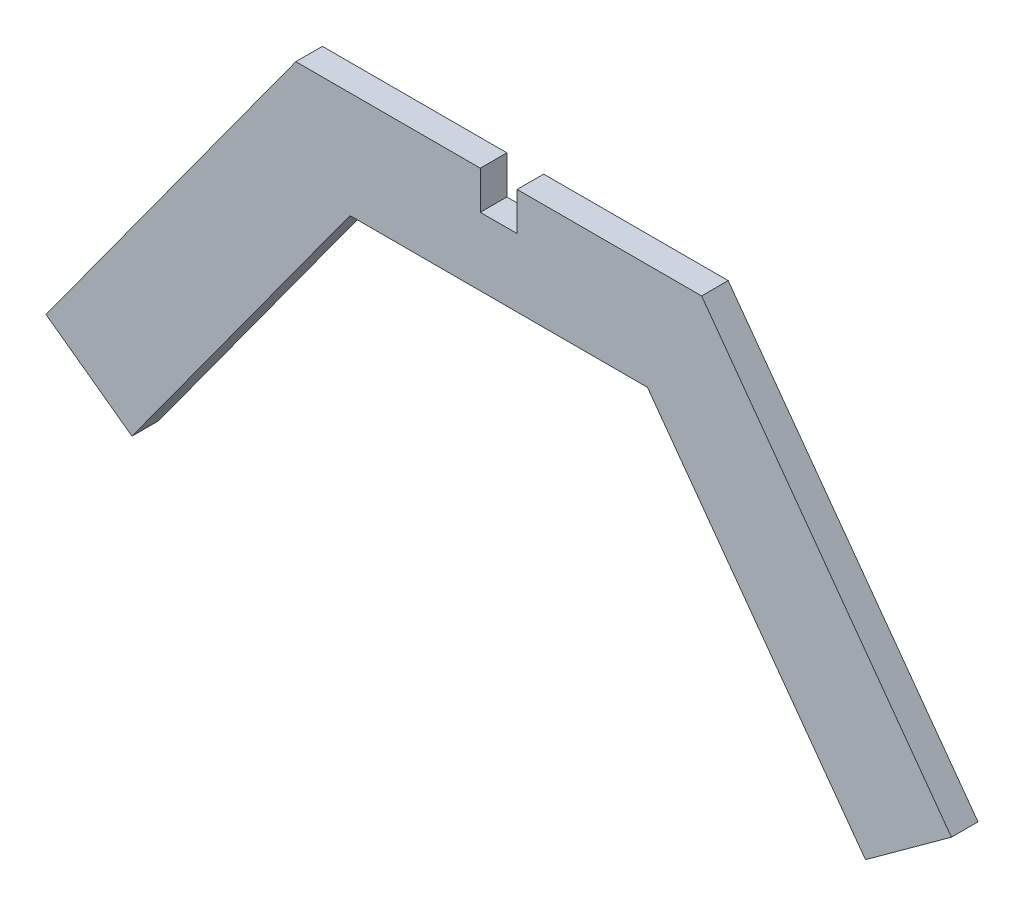
from build123d import *

# Parameters (mm, degrees)
BOSS_EXTRUDE1_DEPTH = 4.7625
SKETCH2_W           = 6.604
SKETCH2_H           = 6.858
CUT_EXTRUDE1_DEPTH  = 110.164366062


with BuildPart() as part:
    # Sketch1 → Boss-Extrude1 (new body)
    with BuildSketch(Plane.XY):
        Polygon((36.376459813, 0), (-36.376459813, 0), (-81.165696038, -61.647094971), (-65.753922295, -72.844404028), (-26.67, -19.05), (26.67, -19.05), (65.753922295, -72.844404028), (81.165696038, -61.647094971), align=None)
    extrude(amount=BOSS_EXTRUDE1_DEPTH)

    # Sketch2 → Cut-Extrude1 (cut, through all)
    with BuildSketch(Plane.XY.offset(4.7625)):
        with Locations((0, -3.429)):
            Rectangle(SKETCH2_W, SKETCH2_H)
    extrude(amount=-CUT_EXTRUDE1_DEPTH, mode=Mode.SUBTRACT)


solid = part.part
